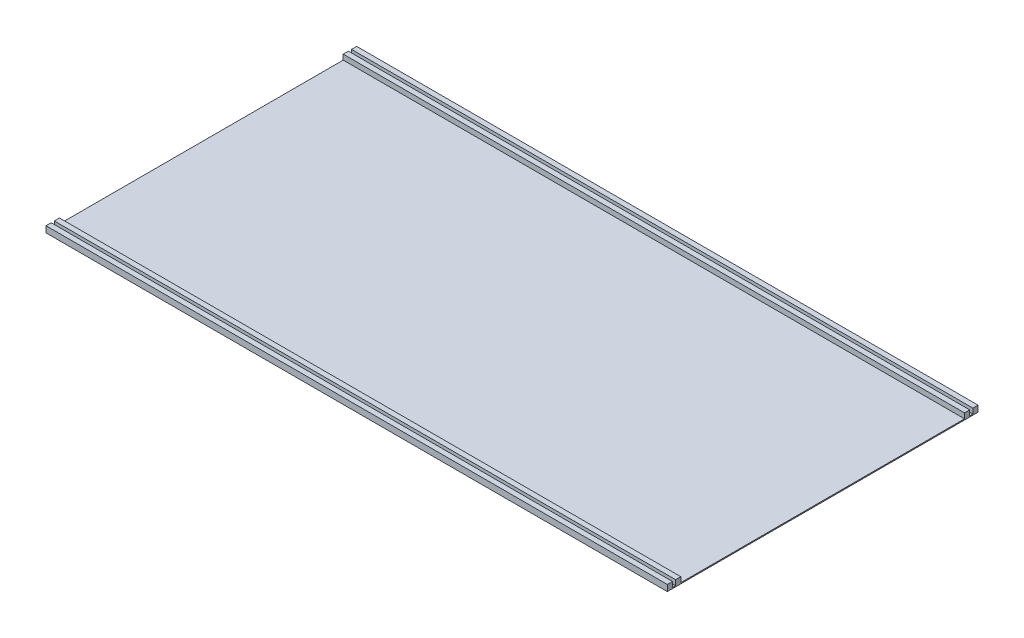
from build123d import *

# Parameters (mm, degrees)
SKETCH1_W           = 6000
SKETCH1_H           = 3000
BOSS_EXTRUDE1_DEPTH = 10
SKETCH3_W           = 6000
SKETCH3_H           = 50
BOSS_EXTRUDE2_DEPTH = 50
SKETCH4_W           = 6000
SKETCH4_H           = 50
BOSS_EXTRUDE3_DEPTH = 50


with BuildPart() as part:
    # Sketch1 → Boss-Extrude1 (new body)
    with BuildSketch(Plane(origin=(0, 0, 0), x_dir=(1, 0, 0), z_dir=(0, 1, 0))):
        with Locations((3000, -1500)):
            Rectangle(SKETCH1_W, SKETCH1_H)
    extrude(amount=BOSS_EXTRUDE1_DEPTH)

    # Sketch3 → Boss-Extrude2 (add)
    with BuildSketch(Plane(origin=(0, 10, 0), x_dir=(1, 0, 0), z_dir=(0, 1, 0))):
        with Locations((3000, -2975)):
            Rectangle(SKETCH3_W, SKETCH3_H)
        with Locations((3000, -2895)):
            Rectangle(SKETCH3_W, SKETCH3_H)
    extrude(amount=BOSS_EXTRUDE2_DEPTH)

    # Sketch4 → Boss-Extrude3 (add)
    with BuildSketch(Plane(origin=(0, 10, 0), x_dir=(1, 0, 0), z_dir=(0, 1, 0))):
        with Locations((3000, -25)):
            Rectangle(SKETCH4_W, SKETCH4_H)
        with Locations((3000, -105)):
            Rectangle(SKETCH4_W, SKETCH4_H)
    extrude(amount=BOSS_EXTRUDE3_DEPTH)


solid = part.part
